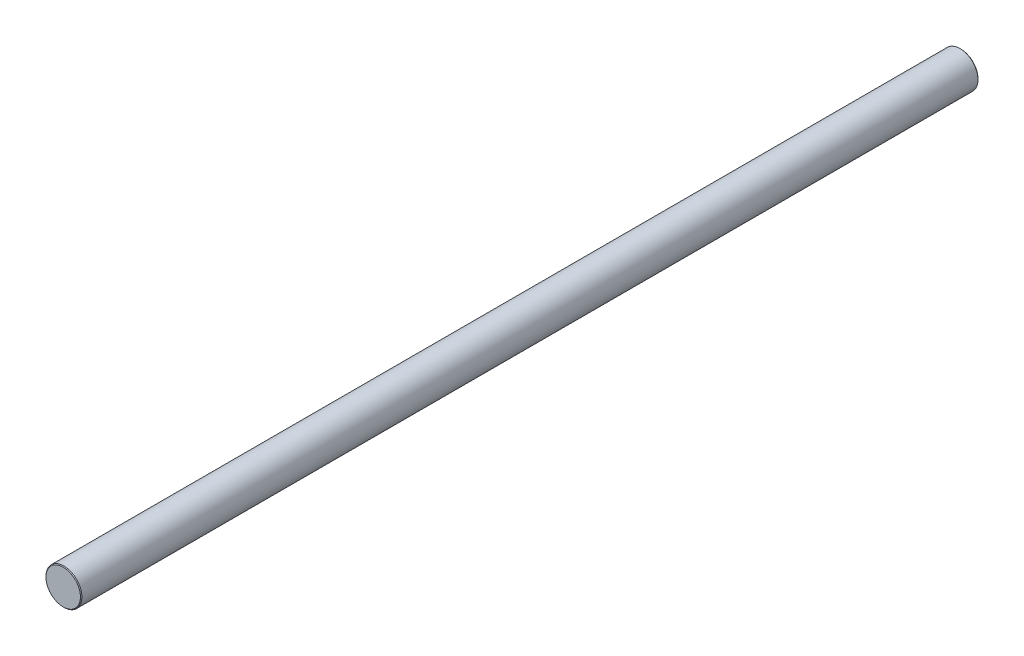
from build123d import *

# Parameters (mm, degrees)
SKIZZE1_R                       = 5
AUFSATZ_LINEAR_AUSTRAGEN1_DEPTH = 250
FASE1_SIZE                      = 0.2


with BuildPart() as part:
    # Skizze1 → Aufsatz-Linear austragen1 (new body)
    with BuildSketch(Plane.XY):
        Circle(SKIZZE1_R)
    extrude(amount=AUFSATZ_LINEAR_AUSTRAGEN1_DEPTH)

    # Fase1
    fase1_edges = [part.edges().sort_by_distance(p)[0] for p in [
        (-5, 0, 0),
        (-5, 0, 250),
    ]]
    chamfer(fase1_edges, length=FASE1_SIZE)


solid = part.part
